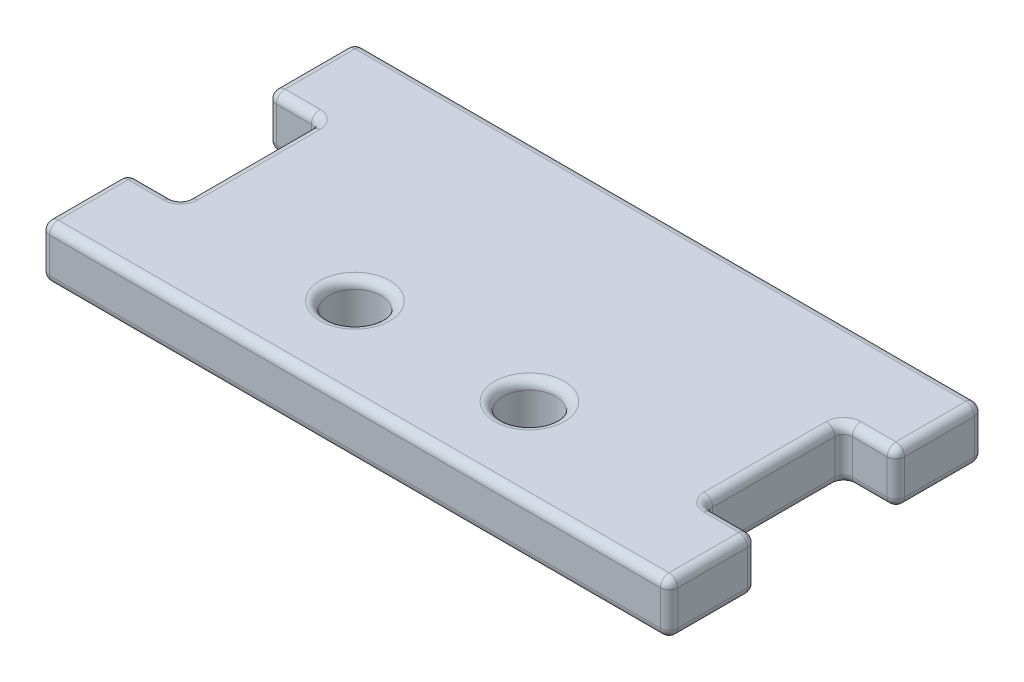
from build123d import *

# Parameters (mm, degrees)
SKETCH_1_R      = 1.5
EXTRUDE_1_DEPTH = 3
FILLET_1_R      = 0.5
FILLET_2_R      = 0.5


with BuildPart() as part:
    # 草图1 → 凸台-拉伸1 (new body)
    with BuildSketch(Plane.XZ.offset(1.5)):
        Polygon((18, -9), (18, -4), (15, -4), (15, 4), (18, 4), (18, 9), (-18, 9), (-18, 4), (-15, 4), (-15, -4), (-18, -4), (-18, -9), align=None)
        with Locations(Location((5, 4, 0), (0, 0, 90))):
            Circle(SKETCH_1_R, mode=Mode.SUBTRACT)
        with Locations(Location((-5, 4, 0), (0, 0, 90))):
            Circle(SKETCH_1_R, mode=Mode.SUBTRACT)
    extrude(amount=-EXTRUDE_1_DEPTH)

    # 圆角1
    fillet_1_edges = [part.edges().sort_by_distance(p)[0] for p in [
        (-18, -1.5, -6.5),
        (-16.5, -1.5, -4),
        (16.5, 1.5, -4),
        (-15, -1.5, 0),
        (-16.5, -1.5, 4),
        (-18, -1.5, 6.5),
        (0, -1.5, 9),
        (18, -1.5, 6.5),
        (16.5, -1.5, 4),
        (15, -1.5, 0),
        (16.5, -1.5, -4),
        (18, -1.5, -6.5),
        (0, -1.5, -9),
        (15, 1.5, 0),
        (-18, 0, -9),
        (-18, 0, -4),
        (-15, 0, -4),
        (16.5, 1.5, 4),
        (-15, 0, 4),
        (-18, 0, 4),
        (-18, 0, 9),
        (18, 0, 9),
        (18, 0, 4),
        (15, 0, 4),
        (15, 0, -4),
        (18, 0, -4),
        (18, 0, -9),
        (18, 1.5, 6.5),
        (0, 1.5, 9),
        (5, 1.5, 2.5),
        (-18, 1.5, 6.5),
        (-5, 1.5, 2.5),
        (-16.5, 1.5, 4),
        (-15, 1.5, 0),
        (-16.5, 1.5, -4),
        (-18, 1.5, -6.5),
        (0, 1.5, -9),
        (18, 1.5, -6.5),
    ]]
    fillet(fillet_1_edges, radius=FILLET_1_R)

    # 圆角2
    fillet_2_edges = [part.edges().sort_by_distance(p)[0] for p in [
        (5, -1.5, 2.5),
        (-5, -1.5, 2.5),
    ]]
    fillet(fillet_2_edges, radius=FILLET_2_R)


solid = part.part
